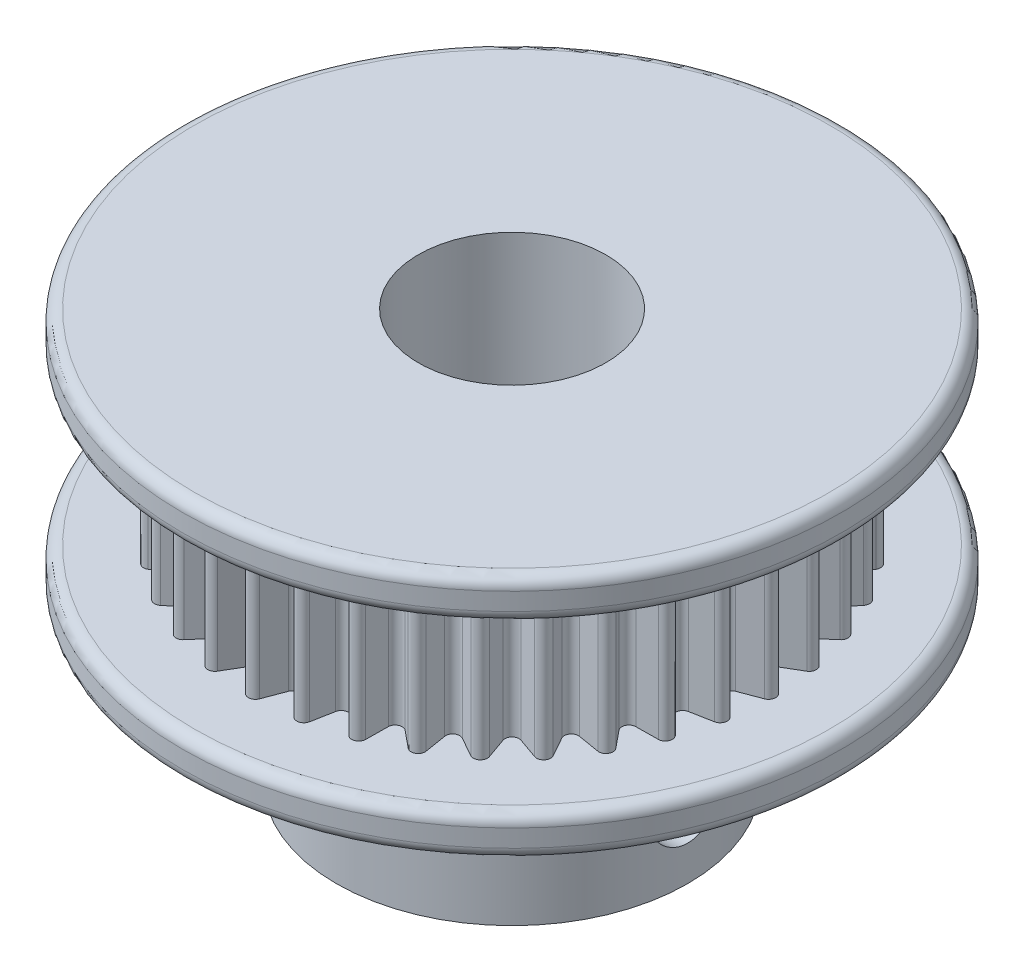
from build123d import *

# Parameters (mm, degrees)
SKETCH1_R           = 7.5
BOSS_EXTRUDE1_DEPTH = 7
SKETCH7_R           = 14.065
BOSS_EXTRUDE5_DEPTH = 1.75
BOSS_EXTRUDE7_DEPTH = 7
SKETCH8_R           = 14.065
BOSS_EXTRUDE6_DEPTH = 1.75
SKETCH4_R           = 4
CUT_EXTRUDE4_DEPTH  = 27.493366151
SKETCH5_R           = 1.5
CUT_EXTRUDE2_DEPTH  = 27.493366151
SKETCH6_R           = 1.5
CUT_EXTRUDE3_DEPTH  = 27.493366217
FILLET1_R           = 0.5


with BuildPart() as part:
    # Sketch1 → Boss-Extrude1 (new body)
    with BuildSketch(Plane(origin=(0, 0, 0), x_dir=(1, 0, 0), z_dir=(0, 1, 0))):
        with Locations(Location((0, 0, 0), (0, 0, 270))):
            Circle(SKETCH1_R)
    extrude(amount=BOSS_EXTRUDE1_DEPTH)

    # Sketch7 → Boss-Extrude5 (add)
    with BuildSketch(Plane(origin=(0, 7, 0), x_dir=(1, 0, 0), z_dir=(0, 1, 0))):
        with Locations(Location((0, 0, 0), (0, 0, 270))):
            Circle(SKETCH7_R)
    extrude(amount=BOSS_EXTRUDE5_DEPTH)

    # Sketch9 → Boss-Extrude7 (add)
    with BuildSketch(Plane(origin=(0, 8.75, 0), x_dir=(1, 0, 0), z_dir=(0, 1, 0))):
        with BuildLine():
            Line((0.280660726, 11.055969605), (0.617769602, 10.163136024))
            ThreePointArc((0.617769602, 10.163136024), (0.872283604, 9.970247219), (1.156425757, 10.116009717))
            Line((1.156425757, 10.116009717), (1.643452116, 10.936740807))
            ThreePointArc((1.643452116, 10.936740807), (1.776289931, 11.056290401), (1.953541999, 11.079087221))
            ThreePointArc((1.953541999, 11.079087221), (2.112307487, 10.99704144), (2.196245833, 10.83926836))
            Line((2.196245833, 10.83926836), (2.373194343, 9.901460586))
            ThreePointArc((2.373194343, 9.901460586), (2.590346917, 9.667306303), (2.895483704, 9.761513574))
            Line((2.895483704, 9.761513574), (3.517629496, 10.485204675))
            ThreePointArc((3.517629496, 10.485204675), (3.669208776, 10.579870997), (3.847726612, 10.571541984))
            ThreePointArc((3.847726612, 10.571541984), (3.989832996, 10.463173324), (4.045099122, 10.293221432))
            Line((4.045099122, 10.293221432), (4.056510776, 9.338934278))
            ThreePointArc((4.056510776, 9.338934278), (4.229703849, 9.070629176), (4.546563843, 9.11041878))
            Line((4.546563843, 9.11041878), (5.284925484, 9.715080904))
            ThreePointArc((5.284925484, 9.715080904), (5.450640568, 9.781987566), (5.625, 9.742785793))
            ThreePointArc((5.625, 9.742785793), (5.746129448, 9.611386982), (5.771044121, 9.434420178))
            Line((5.771044121, 9.434420178), (5.616572181, 8.492649178))
            ThreePointArc((5.616572181, 8.492649178), (5.74054337, 8.198345572), (6.059498941, 8.182508521))
            Line((6.059498941, 8.182508521), (6.891641686, 8.649769316))
            ThreePointArc((6.891641686, 8.649769316), (7.066457405, 8.686883393), (7.231360609, 8.617999985))
            ThreePointArc((7.231360609, 8.617999985), (7.327832664, 8.46756351), (7.321638864, 8.288958842))
            Line((7.321638864, 8.288958842), (7.005976882, 7.38831923))
            ThreePointArc((7.005976882, 7.38831923), (7.076959386, 7.076959386), (7.38831923, 7.005976882))
            Line((7.38831923, 7.005976882), (8.288958842, 7.321638864))
            ThreePointArc((8.288958842, 7.321638864), (8.46756351, 7.327832664), (8.617999985, 7.231360609))
            ThreePointArc((8.617999985, 7.231360609), (8.686883393, 7.066457405), (8.649769316, 6.891641686))
            Line((8.649769316, 6.891641686), (8.182508521, 6.059498941))
            ThreePointArc((8.182508521, 6.059498941), (8.198345572, 5.74054337), (8.492649178, 5.616572181))
            Line((8.492649178, 5.616572181), (9.434420178, 5.771044121))
            ThreePointArc((9.434420178, 5.771044121), (9.611386982, 5.746129448), (9.742785793, 5.625))
            ThreePointArc((9.742785793, 5.625), (9.781987566, 5.450640568), (9.715080904, 5.284925484))
            Line((9.715080904, 5.284925484), (9.11041878, 4.546563843))
            ThreePointArc((9.11041878, 4.546563843), (9.070629176, 4.229703849), (9.338934278, 4.056510776))
            Line((9.338934278, 4.056510776), (10.293221432, 4.045099122))
            ThreePointArc((10.293221432, 4.045099122), (10.463173324, 3.989832996), (10.571541984, 3.847726612))
            ThreePointArc((10.571541984, 3.847726612), (10.579870997, 3.669208776), (10.485204675, 3.517629496))
            Line((10.485204675, 3.517629496), (9.761513574, 2.895483704))
            ThreePointArc((9.761513574, 2.895483704), (9.667306303, 2.590346917), (9.901460586, 2.373194343))
            Line((9.901460586, 2.373194343), (10.83926836, 2.196245833))
            ThreePointArc((10.83926836, 2.196245833), (10.99704144, 2.112307487), (11.079087221, 1.953541999))
            ThreePointArc((11.079087221, 1.953541999), (11.056290401, 1.776289931), (10.936740807, 1.643452116))
            Line((10.936740807, 1.643452116), (10.116009717, 1.156425757))
            ThreePointArc((10.116009717, 1.156425757), (9.970247219, 0.872283604), (10.163136024, 0.617769602))
            Line((10.163136024, 0.617769602), (11.055969605, 0.280660726))
            ThreePointArc((11.055969605, 0.280660726), (11.196770016, 0.170600584), (11.25, 0))
            ThreePointArc((11.25, 0), (11.196770016, -0.170600584), (11.055969605, -0.280660726))
            Line((11.055969605, -0.280660726), (10.163136024, -0.617769602))
            ThreePointArc((10.163136024, -0.617769602), (9.970247219, -0.872283604), (10.116009717, -1.156425757))
            Line((10.116009717, -1.156425757), (10.936740807, -1.643452116))
            ThreePointArc((10.936740807, -1.643452116), (11.056290401, -1.776289931), (11.079087221, -1.953541999))
            ThreePointArc((11.079087221, -1.953541999), (10.99704144, -2.112307487), (10.83926836, -2.196245833))
            Line((10.83926836, -2.196245833), (9.901460586, -2.373194343))
            ThreePointArc((9.901460586, -2.373194343), (9.667306303, -2.590346917), (9.761513574, -2.895483704))
            Line((9.761513574, -2.895483704), (10.485204675, -3.517629496))
            ThreePointArc((10.485204675, -3.517629496), (10.579870997, -3.669208776), (10.571541984, -3.847726612))
            ThreePointArc((10.571541984, -3.847726612), (10.463173324, -3.989832996), (10.293221432, -4.045099122))
            Line((10.293221432, -4.045099122), (9.338934278, -4.056510776))
            ThreePointArc((9.338934278, -4.056510776), (9.070629176, -4.229703849), (9.11041878, -4.546563843))
            Line((9.11041878, -4.546563843), (9.715080904, -5.284925484))
            ThreePointArc((9.715080904, -5.284925484), (9.781987566, -5.450640568), (9.742785793, -5.625))
            ThreePointArc((9.742785793, -5.625), (9.611386982, -5.746129448), (9.434420178, -5.771044121))
            Line((9.434420178, -5.771044121), (8.492649178, -5.616572181))
            ThreePointArc((8.492649178, -5.616572181), (8.198345572, -5.74054337), (8.182508521, -6.059498941))
            Line((8.182508521, -6.059498941), (8.649769316, -6.891641686))
            ThreePointArc((8.649769316, -6.891641686), (8.686883393, -7.066457405), (8.617999985, -7.231360609))
            ThreePointArc((8.617999985, -7.231360609), (8.46756351, -7.327832664), (8.288958842, -7.321638864))
            Line((8.288958842, -7.321638864), (7.38831923, -7.005976882))
            ThreePointArc((7.38831923, -7.005976882), (7.076959386, -7.076959386), (7.005976882, -7.38831923))
            Line((7.005976882, -7.38831923), (7.321638864, -8.288958842))
            ThreePointArc((7.321638864, -8.288958842), (7.327832664, -8.46756351), (7.231360609, -8.617999985))
            ThreePointArc((7.231360609, -8.617999985), (7.066457405, -8.686883393), (6.891641686, -8.649769316))
            Line((6.891641686, -8.649769316), (6.059498941, -8.182508521))
            ThreePointArc((6.059498941, -8.182508521), (5.74054337, -8.198345572), (5.616572181, -8.492649178))
            Line((5.616572181, -8.492649178), (5.771044121, -9.434420178))
            ThreePointArc((5.771044121, -9.434420178), (5.746129448, -9.611386982), (5.625, -9.742785793))
            ThreePointArc((5.625, -9.742785793), (5.450640568, -9.781987566), (5.284925484, -9.715080904))
            Line((5.284925484, -9.715080904), (4.546563843, -9.11041878))
            ThreePointArc((4.546563843, -9.11041878), (4.229703849, -9.070629176), (4.056510776, -9.338934278))
            Line((4.056510776, -9.338934278), (4.045099122, -10.293221432))
            ThreePointArc((4.045099122, -10.293221432), (3.989832996, -10.463173324), (3.847726612, -10.571541984))
            ThreePointArc((3.847726612, -10.571541984), (3.669208776, -10.579870997), (3.517629496, -10.485204675))
            Line((3.517629496, -10.485204675), (2.895483704, -9.761513574))
            ThreePointArc((2.895483704, -9.761513574), (2.590346917, -9.667306303), (2.373194343, -9.901460586))
            Line((2.373194343, -9.901460586), (2.196245833, -10.83926836))
            ThreePointArc((2.196245833, -10.83926836), (2.112307487, -10.99704144), (1.953541999, -11.079087221))
            ThreePointArc((1.953541999, -11.079087221), (1.776289931, -11.056290401), (1.643452116, -10.936740807))
            Line((1.643452116, -10.936740807), (1.156425757, -10.116009717))
            ThreePointArc((1.156425757, -10.116009717), (0.872283604, -9.970247219), (0.617769602, -10.163136024))
            Line((0.617769602, -10.163136024), (0.280660726, -11.055969605))
            ThreePointArc((0.280660726, -11.055969605), (0.170600584, -11.196770016), (0, -11.25))
            ThreePointArc((0, -11.25), (-0.170600584, -11.196770016), (-0.280660726, -11.055969605))
            Line((-0.280660726, -11.055969605), (-0.617769602, -10.163136024))
            ThreePointArc((-0.617769602, -10.163136024), (-0.872283604, -9.970247219), (-1.156425757, -10.116009717))
            Line((-1.156425757, -10.116009717), (-1.643452116, -10.936740807))
            ThreePointArc((-1.643452116, -10.936740807), (-1.776289931, -11.056290401), (-1.953541999, -11.079087221))
            ThreePointArc((-1.953541999, -11.079087221), (-2.112307487, -10.99704144), (-2.196245833, -10.83926836))
            Line((-2.196245833, -10.83926836), (-2.373194343, -9.901460586))
            ThreePointArc((-2.373194343, -9.901460586), (-2.590346917, -9.667306303), (-2.895483704, -9.761513574))
            Line((-2.895483704, -9.761513574), (-3.517629496, -10.485204675))
            ThreePointArc((-3.517629496, -10.485204675), (-3.669208776, -10.579870997), (-3.847726612, -10.571541984))
            ThreePointArc((-3.847726612, -10.571541984), (-3.989832996, -10.463173324), (-4.045099122, -10.293221432))
            Line((-4.045099122, -10.293221432), (-4.056510776, -9.338934278))
            ThreePointArc((-4.056510776, -9.338934278), (-4.229703849, -9.070629176), (-4.546563843, -9.11041878))
            Line((-4.546563843, -9.11041878), (-5.284925484, -9.715080904))
            ThreePointArc((-5.284925484, -9.715080904), (-5.450640568, -9.781987566), (-5.625, -9.742785793))
            ThreePointArc((-5.625, -9.742785793), (-5.746129448, -9.611386982), (-5.771044121, -9.434420178))
            Line((-5.771044121, -9.434420178), (-5.616572181, -8.492649178))
            ThreePointArc((-5.616572181, -8.492649178), (-5.74054337, -8.198345572), (-6.059498941, -8.182508521))
            Line((-6.059498941, -8.182508521), (-6.891641686, -8.649769316))
            ThreePointArc((-6.891641686, -8.649769316), (-7.066457405, -8.686883393), (-7.231360609, -8.617999985))
            ThreePointArc((-7.231360609, -8.617999985), (-7.327832664, -8.46756351), (-7.321638864, -8.288958842))
            Line((-7.321638864, -8.288958842), (-7.005976882, -7.38831923))
            ThreePointArc((-7.005976882, -7.38831923), (-7.076959386, -7.076959386), (-7.38831923, -7.005976882))
            Line((-7.38831923, -7.005976882), (-8.288958842, -7.321638864))
            ThreePointArc((-8.288958842, -7.321638864), (-8.46756351, -7.327832664), (-8.617999985, -7.231360609))
            ThreePointArc((-8.617999985, -7.231360609), (-8.686883393, -7.066457405), (-8.649769316, -6.891641686))
            Line((-8.649769316, -6.891641686), (-8.182508521, -6.059498941))
            ThreePointArc((-8.182508521, -6.059498941), (-8.198345572, -5.74054337), (-8.492649178, -5.616572181))
            Line((-8.492649178, -5.616572181), (-9.434420178, -5.771044121))
            ThreePointArc((-9.434420178, -5.771044121), (-9.611386982, -5.746129448), (-9.742785793, -5.625))
            ThreePointArc((-9.742785793, -5.625), (-9.781987566, -5.450640568), (-9.715080904, -5.284925484))
            Line((-9.715080904, -5.284925484), (-9.11041878, -4.546563843))
            ThreePointArc((-9.11041878, -4.546563843), (-9.070629176, -4.229703849), (-9.338934278, -4.056510776))
            Line((-9.338934278, -4.056510776), (-10.293221432, -4.045099122))
            ThreePointArc((-10.293221432, -4.045099122), (-10.463173324, -3.989832996), (-10.571541984, -3.847726612))
            ThreePointArc((-10.571541984, -3.847726612), (-10.579870997, -3.669208776), (-10.485204675, -3.517629496))
            Line((-10.485204675, -3.517629496), (-9.761513574, -2.895483704))
            ThreePointArc((-9.761513574, -2.895483704), (-9.667306303, -2.590346917), (-9.901460586, -2.373194343))
            Line((-9.901460586, -2.373194343), (-10.83926836, -2.196245833))
            ThreePointArc((-10.83926836, -2.196245833), (-10.99704144, -2.112307487), (-11.079087221, -1.953541999))
            ThreePointArc((-11.079087221, -1.953541999), (-11.056290401, -1.776289931), (-10.936740807, -1.643452116))
            Line((-10.936740807, -1.643452116), (-10.116009717, -1.156425757))
            ThreePointArc((-10.116009717, -1.156425757), (-9.970247219, -0.872283604), (-10.163136024, -0.617769602))
            Line((-10.163136024, -0.617769602), (-11.055969605, -0.280660726))
            ThreePointArc((-11.055969605, -0.280660726), (-11.196770016, -0.170600584), (-11.25, 0))
            ThreePointArc((-11.25, 0), (-11.196770016, 0.170600584), (-11.055969605, 0.280660726))
            Line((-11.055969605, 0.280660726), (-10.163136024, 0.617769602))
            ThreePointArc((-10.163136024, 0.617769602), (-9.970247219, 0.872283604), (-10.116009717, 1.156425757))
            Line((-10.116009717, 1.156425757), (-10.936740807, 1.643452116))
            ThreePointArc((-10.936740807, 1.643452116), (-11.056290401, 1.776289931), (-11.079087221, 1.953541999))
            ThreePointArc((-11.079087221, 1.953541999), (-10.99704144, 2.112307487), (-10.83926836, 2.196245833))
            Line((-10.83926836, 2.196245833), (-9.901460586, 2.373194343))
            ThreePointArc((-9.901460586, 2.373194343), (-9.667306303, 2.590346917), (-9.761513574, 2.895483704))
            Line((-9.761513574, 2.895483704), (-10.485204675, 3.517629496))
            ThreePointArc((-10.485204675, 3.517629496), (-10.579870997, 3.669208776), (-10.571541984, 3.847726612))
            ThreePointArc((-10.571541984, 3.847726612), (-10.463173324, 3.989832996), (-10.293221432, 4.045099122))
            Line((-10.293221432, 4.045099122), (-9.338934278, 4.056510776))
            ThreePointArc((-9.338934278, 4.056510776), (-9.070629176, 4.229703849), (-9.11041878, 4.546563843))
            Line((-9.11041878, 4.546563843), (-9.715080904, 5.284925484))
            ThreePointArc((-9.715080904, 5.284925484), (-9.781987566, 5.450640568), (-9.742785793, 5.625))
            ThreePointArc((-9.742785793, 5.625), (-9.611386982, 5.746129448), (-9.434420178, 5.771044121))
            Line((-9.434420178, 5.771044121), (-8.492649178, 5.616572181))
            ThreePointArc((-8.492649178, 5.616572181), (-8.198345572, 5.74054337), (-8.182508521, 6.059498941))
            Line((-8.182508521, 6.059498941), (-8.649769316, 6.891641686))
            ThreePointArc((-8.649769316, 6.891641686), (-8.686883393, 7.066457405), (-8.617999985, 7.231360609))
            ThreePointArc((-8.617999985, 7.231360609), (-8.46756351, 7.327832664), (-8.288958842, 7.321638864))
            Line((-8.288958842, 7.321638864), (-7.38831923, 7.005976882))
            ThreePointArc((-7.38831923, 7.005976882), (-7.076959386, 7.076959386), (-7.005976882, 7.38831923))
            Line((-7.005976882, 7.38831923), (-7.321638864, 8.288958842))
            ThreePointArc((-7.321638864, 8.288958842), (-7.327832664, 8.46756351), (-7.231360609, 8.617999985))
            ThreePointArc((-7.231360609, 8.617999985), (-7.066457405, 8.686883393), (-6.891641686, 8.649769316))
            Line((-6.891641686, 8.649769316), (-6.059498941, 8.182508521))
            ThreePointArc((-6.059498941, 8.182508521), (-5.74054337, 8.198345572), (-5.616572181, 8.492649178))
            Line((-5.616572181, 8.492649178), (-5.771044121, 9.434420178))
            ThreePointArc((-5.771044121, 9.434420178), (-5.746129448, 9.611386982), (-5.625, 9.742785793))
            ThreePointArc((-5.625, 9.742785793), (-5.450640568, 9.781987566), (-5.284925484, 9.715080904))
            Line((-5.284925484, 9.715080904), (-4.546563843, 9.11041878))
            ThreePointArc((-4.546563843, 9.11041878), (-4.229703849, 9.070629176), (-4.056510776, 9.338934278))
            Line((-4.056510776, 9.338934278), (-4.045099122, 10.293221432))
            ThreePointArc((-4.045099122, 10.293221432), (-3.989832996, 10.463173324), (-3.847726612, 10.571541984))
            ThreePointArc((-3.847726612, 10.571541984), (-3.669208776, 10.579870997), (-3.517629496, 10.485204675))
            Line((-3.517629496, 10.485204675), (-2.895483704, 9.761513574))
            ThreePointArc((-2.895483704, 9.761513574), (-2.590346917, 9.667306303), (-2.373194343, 9.901460586))
            Line((-2.373194343, 9.901460586), (-2.196245833, 10.83926836))
            ThreePointArc((-2.196245833, 10.83926836), (-2.112307487, 10.99704144), (-1.953541999, 11.079087221))
            ThreePointArc((-1.953541999, 11.079087221), (-1.776289931, 11.056290401), (-1.643452116, 10.936740807))
            Line((-1.643452116, 10.936740807), (-1.156425757, 10.116009717))
            ThreePointArc((-1.156425757, 10.116009717), (-0.872283604, 9.970247219), (-0.617769602, 10.163136024))
            Line((-0.617769602, 10.163136024), (-0.280660726, 11.055969605))
            ThreePointArc((-0.280660726, 11.055969605), (-0.170600584, 11.196770016), (0, 11.25))
            ThreePointArc((0, 11.25), (0.170600584, 11.196770016), (0.280660726, 11.055969605))
        make_face()
    extrude(amount=BOSS_EXTRUDE7_DEPTH)

    # Sketch8 → Boss-Extrude6 (add)
    with BuildSketch(Plane(origin=(0, 15.75, 0), x_dir=(1, 0, 0), z_dir=(0, 1, 0))):
        with Locations(Location((0, 0, 0), (0, 0, 270))):
            Circle(SKETCH8_R)
    extrude(amount=BOSS_EXTRUDE6_DEPTH)

    # Sketch4 → Cut-Extrude4 (cut, through all)
    with BuildSketch(Plane.XZ):
        with Locations(Location((0, 0, 0), (0, 0, 270))):
            Circle(SKETCH4_R)
    extrude(amount=-CUT_EXTRUDE4_DEPTH, mode=Mode.SUBTRACT)

    # Sketch5 → Cut-Extrude2 (cut, through all)
    with BuildSketch(Plane(origin=(0, 0, 0), x_dir=(0, 0, -1), z_dir=(1, 0, 0))):
        with Locations(Location((0, 3, 0), (0, 0, 180))):
            Circle(SKETCH5_R)
    extrude(amount=CUT_EXTRUDE2_DEPTH, mode=Mode.SUBTRACT)

    # Sketch6 → Cut-Extrude3 (cut, through all)
    with BuildSketch(Plane.XY):
        with Locations(Location((0, 3, 0), (0, 0, 90))):
            Circle(SKETCH6_R)
    extrude(amount=-CUT_EXTRUDE3_DEPTH, mode=Mode.SUBTRACT)

    # Fillet1
    fillet1_edges = [part.edges().sort_by_distance(p)[0] for p in [
        (0, 15.75, -14.065),
        (0, 17.5, -14.065),
        (0, 7, -14.065),
        (0, 8.75, -14.065),
    ]]
    fillet(fillet1_edges, radius=FILLET1_R)


solid = part.part
